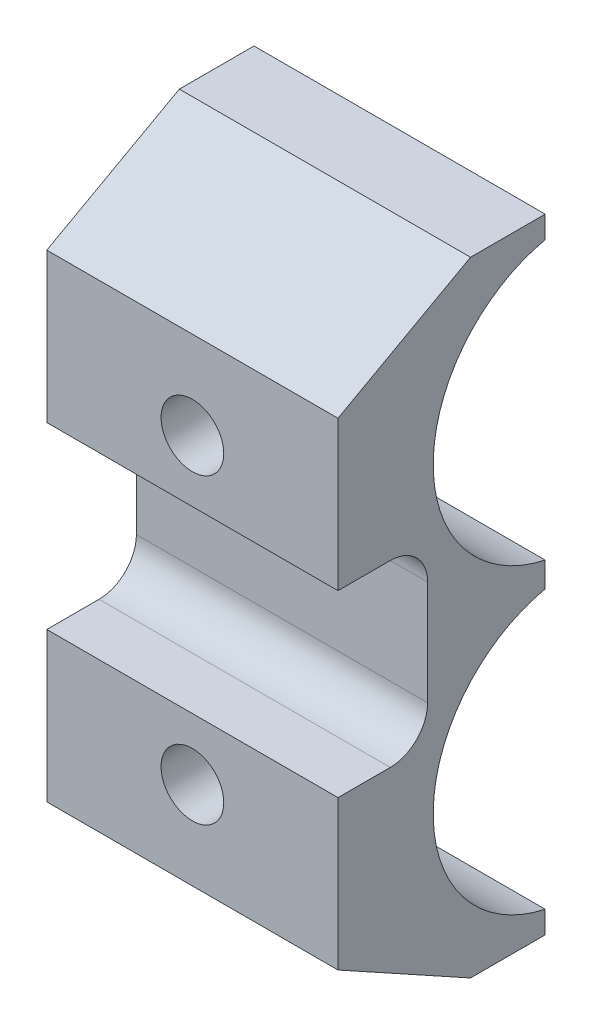
from build123d import *

# Parameters (mm, degrees)
BOSS_EXTRUDE1_DEPTH     = 9.75
SKETCH2_R               = 2.1
CUT_EXTRUDE1_DEPTH      = 27.914459404
CUT_EXTRUDE2_DEPTH      = 33.696722039
CUT_EXTRUDE2_DEPTH_BACK = 33.696722039


with BuildPart() as part:
    # Sketch1 → Boss-Extrude1 (new, symmetric)
    with BuildSketch(Plane(origin=(0, 0, 0), x_dir=(0, 0, -1), z_dir=(1, 0, 0))):
        with BuildLine():
            Line((-15.875, -16), (-15.875, 16))
            Line((-15.875, 16), (-7, 20.9))
            Line((-7, 20.9), (-2, 20.9))
            Line((-2, 20.9), (-2, 19.412087811))
            ThreePointArc((-2, 19.412087811), (-9.5, 10.125), (-2, 0.837912189))
            Line((-2, 0.837912189), (-2, -0.837912189))
            ThreePointArc((-2, -0.837912189), (-9.5, -10.125), (-2, -19.412087811))
            Line((-2, -19.412087811), (-2, -20.9))
            Line((-2, -20.9), (-7, -20.9))
            Line((-7, -20.9), (-15.875, -16))
        make_face()
    extrude(amount=BOSS_EXTRUDE1_DEPTH, both=True)

    # Sketch2 → Cut-Extrude1 (cut, through all)
    with BuildSketch(Plane.XY.offset(15.875)):
        with Locations((0, 10.125)):
            Circle(SKETCH2_R)
        with Locations((0, -10.125)):
            Circle(SKETCH2_R)
    extrude(amount=-CUT_EXTRUDE1_DEPTH, mode=Mode.SUBTRACT)

    # Sketch3 → Cut-Extrude2 (cut, two sides: drawn at the far end of the back side and taken through both)
    with BuildSketch(Plane.ZY.offset(9.75).offset(-CUT_EXTRUDE2_DEPTH_BACK)):
        with BuildLine():
            Line((15.875, 6), (12.375, 6))
            ThreePointArc((12.375, 6), (10.607233047, 5.267766953), (9.875, 3.5))
            Line((9.875, 3.5), (9.875, -3.5))
            ThreePointArc((9.875, -3.5), (10.607233047, -5.267766953), (12.375, -6))
            Line((12.375, -6), (15.875, -6))
            Line((15.875, -6), (15.875, 6))
        make_face()
    extrude(amount=CUT_EXTRUDE2_DEPTH + CUT_EXTRUDE2_DEPTH_BACK, mode=Mode.SUBTRACT)


solid = part.part
